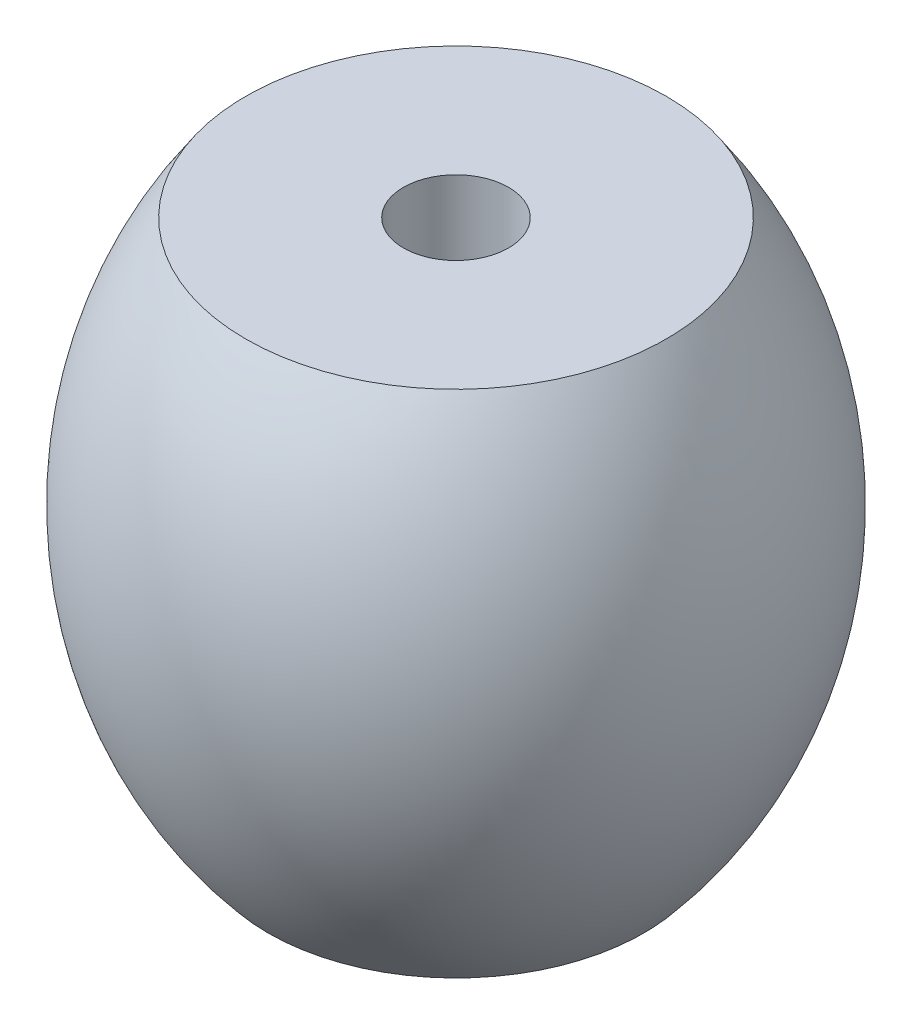
from build123d import *


with BuildPart() as part:
    # Sketch1 → Revolve1 (revolve)
    with BuildSketch(Plane.XY, mode=Mode.PRIVATE) as revolve1_sk:
        with BuildLine():
            Line((-1, 10), (-4, 10))
            ThreePointArc((-4, 10), (-5.5, 4.92713794), (-3.574580251, 0))
            Line((-3.574580251, 0), (-2, 0))
            Line((-2, 0), (-2, 2))
            Line((-2, 2), (-3.715224327, 2))
            ThreePointArc((-3.715224327, 2), (-4.459494144, 4.447269331), (-4.296304477, 7))
            Line((-4.296304477, 7), (-1, 7))
            Line((-1, 7), (-1, 10))
        make_face()
    revolve(revolve1_sk.sketch.rotate(Axis((0, 0, 0), (0, 1, 0)), 270), axis=Axis((0, 0, 0), (0, 1, 0)))


solid = part.part
